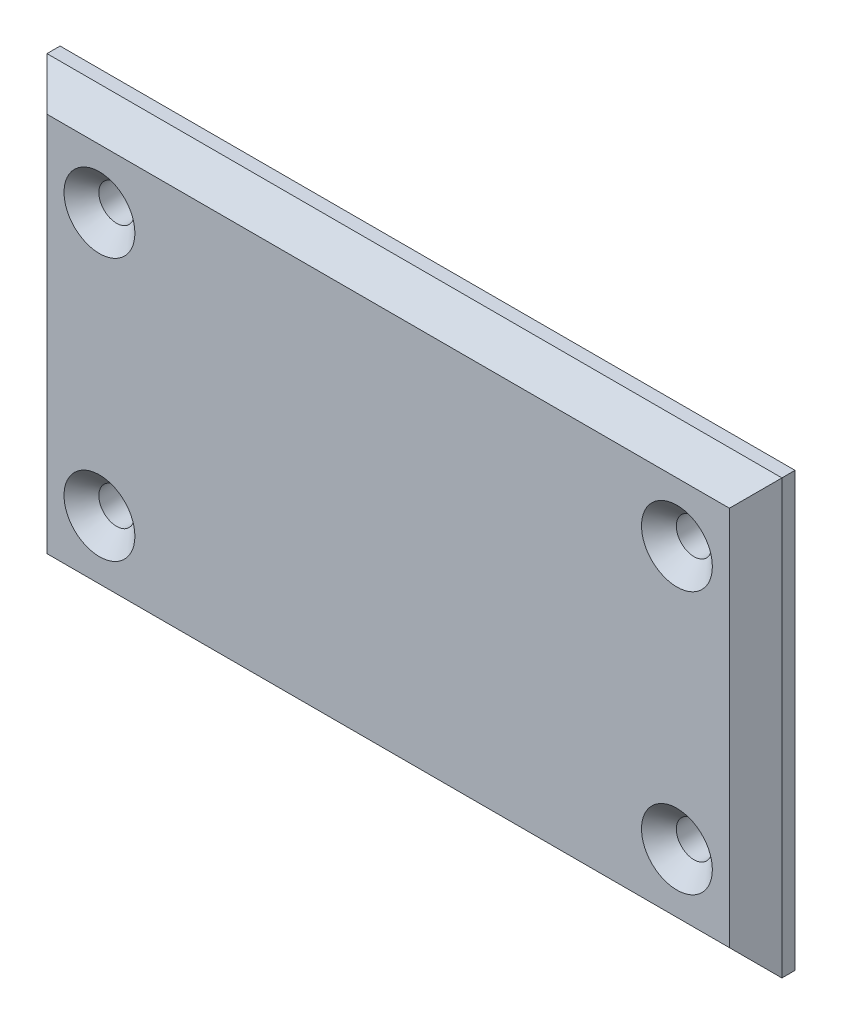
from build123d import *

# Parameters (mm, degrees)
SKETCH_1_W                = 280
SKETCH_1_H                = 165
EXTRUDE_1_DEPTH           = 15
CHAMFER_1_SIZE            = 10
HOLE_WIZARD_1_D           = 13.5
HOLE_WIZARD_1_DEPTH       = 20
HOLE_WIZARD_1_CSINK_D     = 27
HOLE_WIZARD_1_CSINK_ANGLE = 92
HOLE_WIZARD_1_TIP         = 4.055809178


with BuildPart() as part:
    # 草图1 → 凸台-拉伸1 (new body)
    with BuildSketch(Plane.XY):
        Rectangle(SKETCH_1_W, SKETCH_1_H)
    extrude(amount=EXTRUDE_1_DEPTH)

    # 倒角1
    chamfer_1_edges = [part.edges().sort_by_distance(p)[0] for p in [
        (-140, 0, 15),
        (0, -82.5, 15),
        (140, 0, 15),
        (0, 82.5, 15),
    ]]
    chamfer(chamfer_1_edges, length=CHAMFER_1_SIZE)

    # 打孔尺寸(%根据)内六角花形沉头螺钉的类型1
    with Locations(Plane.XY.offset(15)):
        with Locations((-110, 50), (110, 50), (110, -50), (-110, -50)):
            CounterSinkHole(HOLE_WIZARD_1_D / 2, HOLE_WIZARD_1_CSINK_D / 2, depth=HOLE_WIZARD_1_DEPTH, counter_sink_angle=HOLE_WIZARD_1_CSINK_ANGLE)
            with Locations((0, 0, -(HOLE_WIZARD_1_DEPTH + HOLE_WIZARD_1_TIP / 2))):  # 118° drill point
                Cone(0, HOLE_WIZARD_1_D / 2, HOLE_WIZARD_1_TIP, mode=Mode.SUBTRACT)


solid = part.part
